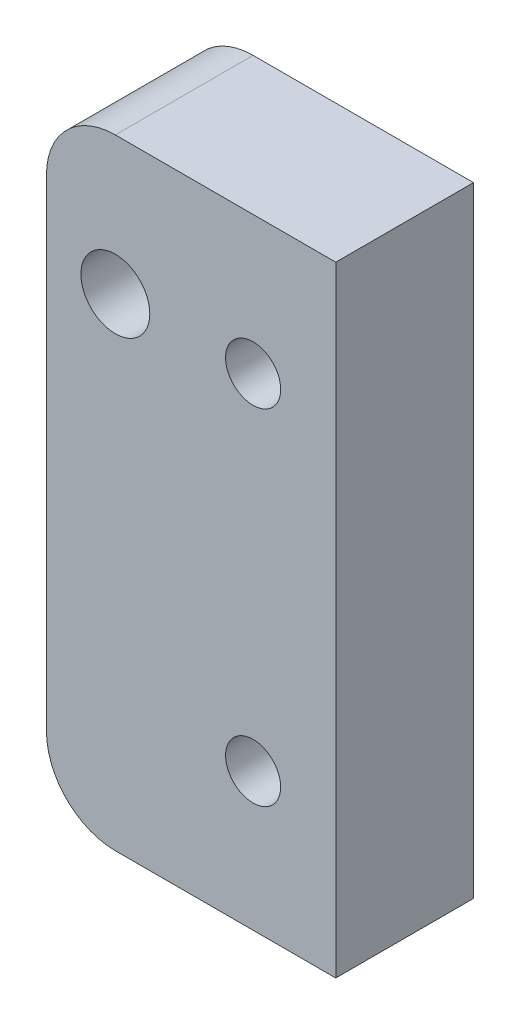
from build123d import *

# Parameters (mm, degrees)
ESQUISSE1_W             = 21
ESQUISSE1_H             = 45
BOSS_EXTRU_1_DEPTH      = 10
ESQUISSE2_R             = 2.5
ENL_V_MAT_EXTRU_1_DEPTH = 10
ESQUISSE4_R             = 2
ENL_V_MAT_EXTRU_3_DEPTH = 10
CONG_1_R                = 5
ENL_V_MAT_EXTRU_6_DEPTH = 4


with BuildPart() as part:
    # Esquisse1 → Boss.-Extru.1 (new body)
    with BuildSketch(Plane.XY):
        with Locations((-17.606794518, -4.650313152)):
            Rectangle(ESQUISSE1_W, ESQUISSE1_H)
    extrude(amount=BOSS_EXTRU_1_DEPTH)

    # Esquisse2 → Enlèv. mat.-Extru.1 (cut)
    with BuildSketch(Plane.XY.offset(10)):
        with Locations((-23.106794518, 7.849686848)):
            Circle(ESQUISSE2_R)
    extrude(amount=-ENL_V_MAT_EXTRU_1_DEPTH, mode=Mode.SUBTRACT)

    # Esquisse4 → Enlèv. mat.-Extru.3 (cut)
    with BuildSketch(Plane.XY.offset(10)):
        with Locations((-13.106794518, 7.849686848)):
            Circle(ESQUISSE4_R)
        with Locations((-13.106794518, -17.150313152)):
            Circle(ESQUISSE4_R)
    extrude(amount=-ENL_V_MAT_EXTRU_3_DEPTH, mode=Mode.SUBTRACT)

    # Congé1
    cong_1_edges = [part.edges().sort_by_distance(p)[0] for p in [
        (-28.106794518, 17.849686848, 5),
        (-28.106794518, -27.150313152, 5),
    ]]
    fillet(cong_1_edges, radius=CONG_1_R)

    # Esquisse7 → Enlèv. mat.-Extru.6 (cut)
    with BuildSketch(Plane(origin=(0, 0, 0), x_dir=(-1, 0, 0), z_dir=(0, 0, -1))):
        Polygon((15.856794518, 9.437400088), (13.106794518, 11.025113328), (10.356794518, 9.437400088), (10.356794518, 6.261973607), (13.106794518, 4.674260367), (15.856794518, 6.261973607), align=None)
        Polygon((15.856794518, -15.562599912), (13.106794518, -13.974886672), (10.356794518, -15.562599912), (10.356794518, -18.738026393), (13.106794518, -20.325739633), (15.856794518, -18.738026393), align=None)
    extrude(amount=-ENL_V_MAT_EXTRU_6_DEPTH, mode=Mode.SUBTRACT)


solid = part.part
